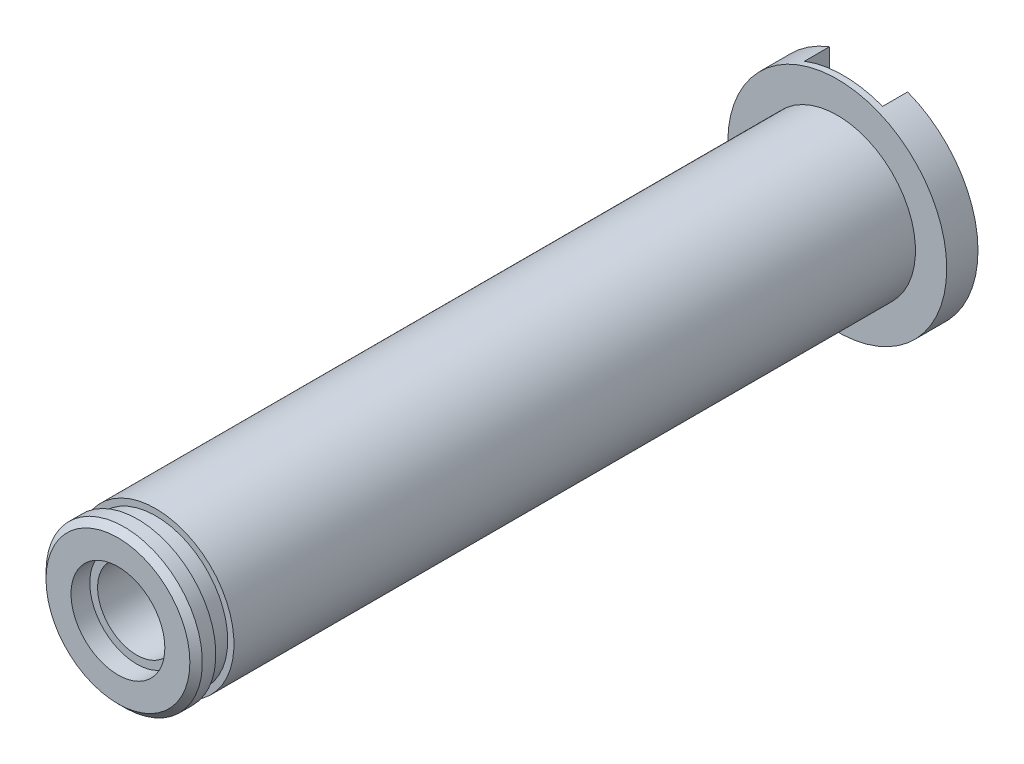
from build123d import *

# Parameters (mm, degrees)
SKETCH2_R           = 4.445
BOSS_EXTRUDE1_DEPTH = 1.27
SKETCH3_R           = 3.175
BOSS_EXTRUDE2_DEPTH = 29.21
SKETCH4_R           = 1.5875
CUT_EXTRUDE1_DEPTH  = 37.592
SKETCH5_R           = 1.905
CUT_EXTRUDE2_DEPTH  = 0.762
SKETCH6_W           = 3.175
SKETCH6_H           = 5.873367688
CUT_EXTRUDE3_DEPTH  = 1.016
CUT_EXTRUDE5_START  = -0.7366
SKETCH7_R           = 3.175
SKETCH7_R_2         = 2.921
CUT_EXTRUDE5_DEPTH  = 0.7366
CHAMFER1_SIZE       = 0.254


with BuildPart() as part:
    # Sketch2 → Boss-Extrude1 (new body)
    with BuildSketch(Plane.XY):
        Circle(SKETCH2_R)
    extrude(amount=BOSS_EXTRUDE1_DEPTH)

    # Sketch3 → Boss-Extrude2 (add)
    with BuildSketch(Plane.XY.offset(1.27)):
        with Locations(Location((0, 0, 0), (0, 0, 180))):
            Circle(SKETCH3_R)
    extrude(amount=BOSS_EXTRUDE2_DEPTH)

    # Sketch4 → Cut-Extrude1 (cut)
    with BuildSketch(Plane.XY.offset(30.48)):
        Circle(SKETCH4_R)
    extrude(amount=-CUT_EXTRUDE1_DEPTH, mode=Mode.SUBTRACT)

    # Sketch5 → Cut-Extrude2 (cut)
    with BuildSketch(Plane.XY.offset(30.48)):
        Circle(SKETCH5_R)
    extrude(amount=-CUT_EXTRUDE2_DEPTH, mode=Mode.SUBTRACT)

    # Sketch6 → Cut-Extrude3 (cut)
    with BuildSketch(Plane(origin=(0, 0, 0), x_dir=(-1, 0, 0), z_dir=(0, 0, -1))):
        with Locations((0, 2.936683844)):
            Rectangle(SKETCH6_W, SKETCH6_H)
    extrude(amount=-CUT_EXTRUDE3_DEPTH, mode=Mode.SUBTRACT)

    # Sketch7 → Cut-Extrude5 (cut)
    with BuildSketch(Plane.XY.offset(29.6799).offset(CUT_EXTRUDE5_START)):
        with Locations(Location((0, 0, 0), (0, 0, 180))):
            Circle(SKETCH7_R)
        Circle(SKETCH7_R_2, mode=Mode.SUBTRACT)
    extrude(amount=CUT_EXTRUDE5_DEPTH, mode=Mode.SUBTRACT)

    # Chamfer1
    chamfer1_edges = [part.edges().sort_by_distance(p)[0] for p in [
        (3.175, 0, 30.48),
    ]]
    chamfer(chamfer1_edges, length=CHAMFER1_SIZE)


solid = part.part
